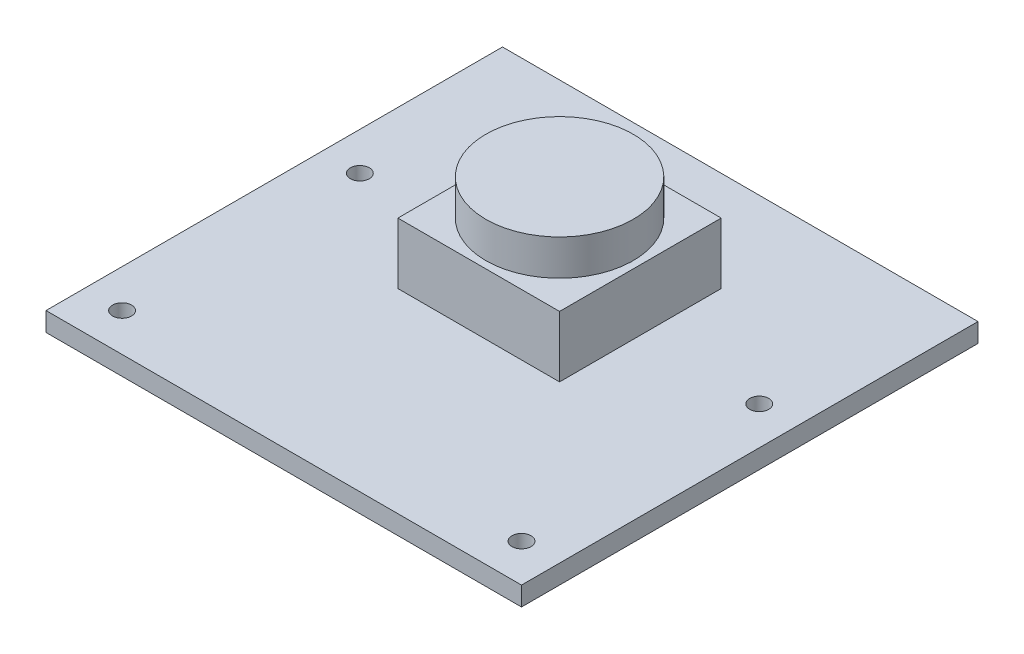
from build123d import *

# Parameters (mm, degrees)
SKETCH1_W           = 25
SKETCH1_H           = 24
BOSS_EXTRUDE1_DEPTH = 1
SKETCH2_R           = 0.5
CUT_EXTRUDE1_DEPTH  = 18.356554958
SKETCH3_W           = 8.5
SKETCH3_H           = 8.5
BOSS_EXTRUDE2_DEPTH = 3.21
SKETCH4_R           = 3.876557288
BOSS_EXTRUDE3_DEPTH = 1.88


with BuildPart() as part:
    # Sketch1 → Boss-Extrude1 (new body)
    with BuildSketch(Plane(origin=(0, 0, 0), x_dir=(1, 0, 0), z_dir=(0, 1, 0))):
        Rectangle(SKETCH1_W, SKETCH1_H)
    extrude(amount=BOSS_EXTRUDE1_DEPTH)

    # Sketch2 → Cut-Extrude1 (cut, through all)
    with BuildSketch(Plane(origin=(0, 1, 0), x_dir=(1, 0, 0), z_dir=(0, 1, 0))):
        with Locations(Location((-10.5, -10, 0), (0, 0, 270))):
            Circle(SKETCH2_R)
        with Locations(Location((10.5, -10, 0), (0, 0, 90))):
            Circle(SKETCH2_R)
        with Locations(Location((-10.5, 2.5, 0), (0, 0, 270))):
            Circle(SKETCH2_R)
        with Locations(Location((10.5, 2.5, 0), (0, 0, 90))):
            Circle(SKETCH2_R)
    extrude(amount=-CUT_EXTRUDE1_DEPTH, mode=Mode.SUBTRACT)

    # Sketch3 → Boss-Extrude2 (add)
    with BuildSketch(Plane(origin=(0, 1, 0), x_dir=(1, 0, 0), z_dir=(0, 1, 0))):
        with Locations((0, 2.5)):
            Rectangle(SKETCH3_W, SKETCH3_H)
    extrude(amount=BOSS_EXTRUDE2_DEPTH)

    # Sketch4 → Boss-Extrude3 (add)
    with BuildSketch(Plane(origin=(0, 4.21, 0), x_dir=(1, 0, 0), z_dir=(0, 1, 0))):
        with Locations(Location((0, 2.5, 0), (0, 0, 270))):
            Circle(SKETCH4_R)
    extrude(amount=BOSS_EXTRUDE3_DEPTH)


solid = part.part
